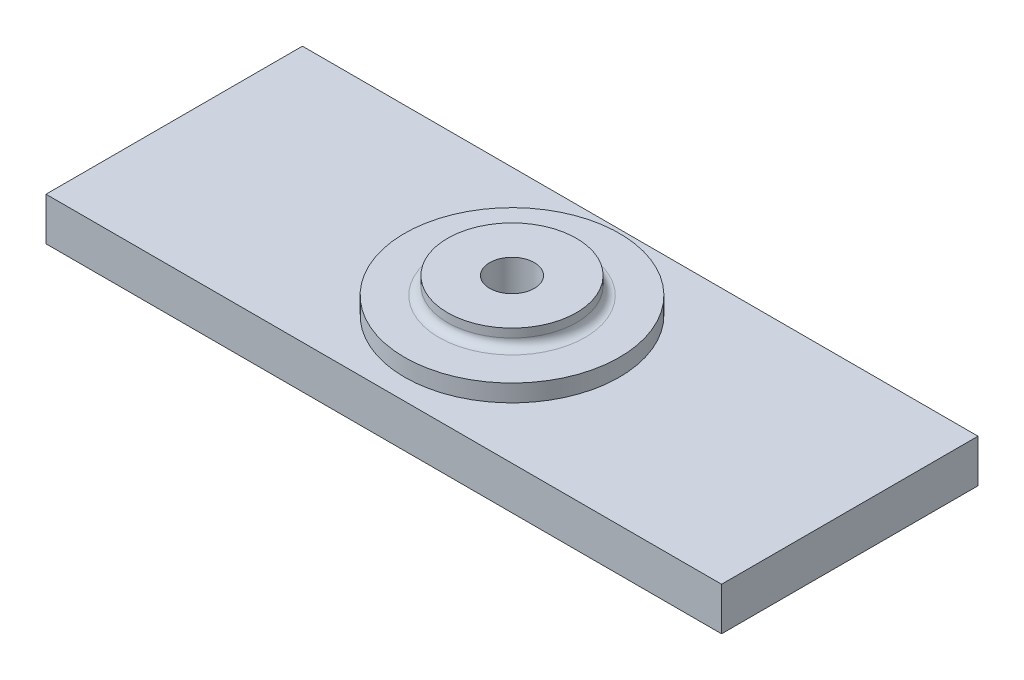
from build123d import *

# Parameters (mm, degrees)
SKETCH_1_R          = 12.5
EXTRUDE_1_DEPTH     = 2
SKETCH_2_R          = 7.5
EXTRUDE_2_DEPTH     = 2
FILLET_1_R          = 1
CUT_EXTRUDE_1_REACH = 20.125
SKETCH_3_R          = 2.6
SKETCH_4_W          = 78.608538246
SKETCH_4_H          = 29.839159416
EXTRUDE_3_DEPTH     = 5


with BuildPart() as part:
    # 草图1 → 凸台-拉伸1 (new body)
    with BuildSketch(Plane(origin=(0, 0, 0), x_dir=(1, 0, 0), z_dir=(0, 1, 0))):
        with Locations(Location((0, 0, 0), (0, 0, 270))):
            Circle(SKETCH_1_R)
    extrude(amount=EXTRUDE_1_DEPTH)

    # 草图2 → 凸台-拉伸2 (add)
    with BuildSketch(Plane(origin=(0, 2, 0), x_dir=(1, 0, 0), z_dir=(0, 1, 0))):
        with Locations(Location((0, 0, 0), (0, 0, 270))):
            Circle(SKETCH_2_R)
    extrude(amount=EXTRUDE_2_DEPTH)

    # 圆角1
    fillet_1_edges = [part.edges().sort_by_distance(p)[0] for p in [
        (0, 2, -7.5),
    ]]
    fillet(fillet_1_edges, radius=FILLET_1_R)

    # 草图3 → 切除-拉伸1 (cut, up to next)
    with BuildSketch(Plane(origin=(0, 4, 0), x_dir=(1, 0, 0), z_dir=(0, 1, 0)), mode=Mode.PRIVATE) as cut_extrude_1_sk1:
        with Locations(Location((0, 0, 0), (0, 0, 270))):
            Circle(SKETCH_3_R)
    cut_extrude_1_tool1 = extrude(cut_extrude_1_sk1.sketch, amount=-CUT_EXTRUDE_1_REACH, mode=Mode.PRIVATE) & part.part
    add(cut_extrude_1_tool1.solids().sort_by_distance((0, 4, 0))[0], mode=Mode.SUBTRACT)

    # 草图4 → 凸台-拉伸3 (add)
    with BuildSketch(Plane(origin=(0, 0, 0), x_dir=(1, 0, 0), z_dir=(0, 1, 0))):
        Rectangle(SKETCH_4_W, SKETCH_4_H)
    extrude(amount=-EXTRUDE_3_DEPTH)


solid = part.part
